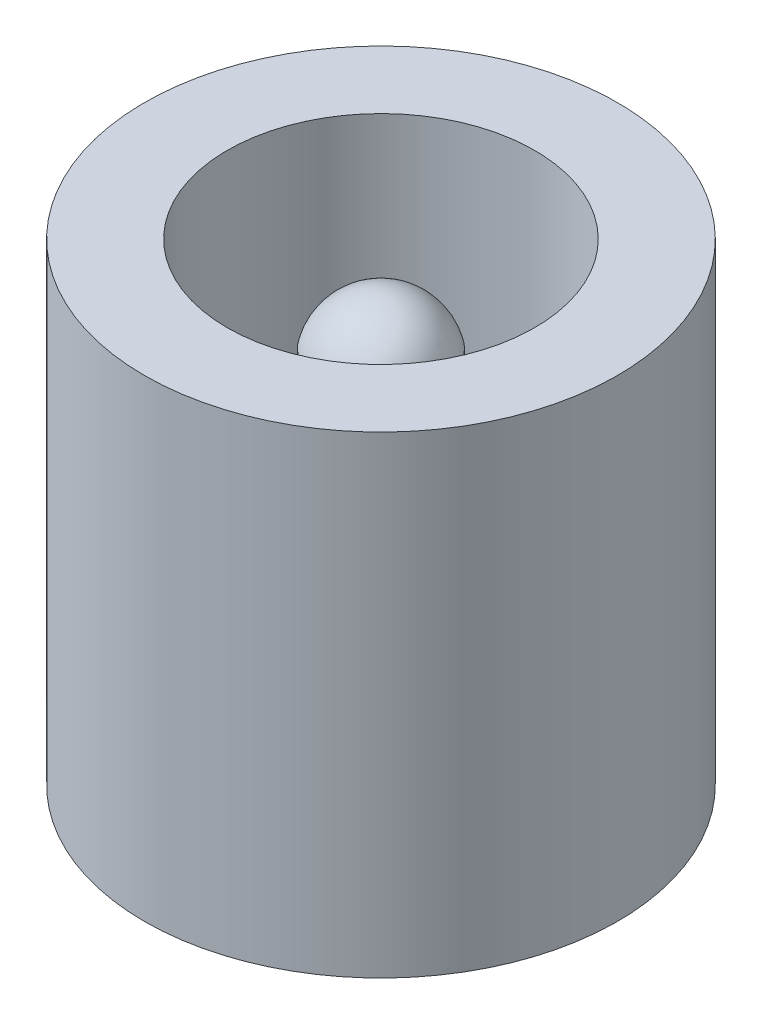
from build123d import *

# Parameters (mm, degrees)
SKETCH1_R           = 5
BOSS_EXTRUDE1_DEPTH = 10
SKETCH2_R           = 3.25
CUT_EXTRUDE1_DEPTH  = 8
SKETCH3_R           = 1.25
BOSS_EXTRUDE2_DEPTH = 6
DOME1_FACE_RADIUS   = 1.25
DOME1_HEIGHT        = 1


with BuildPart() as part:
    # Sketch1 → Boss-Extrude1 (new body)
    with BuildSketch(Plane(origin=(0, 0, 0), x_dir=(1, 0, 0), z_dir=(0, 1, 0))):
        with Locations(Location((0, 0, 0), (0, 0, 270))):
            Circle(SKETCH1_R)
    extrude(amount=BOSS_EXTRUDE1_DEPTH)

    # Sketch2 → Cut-Extrude1 (cut)
    with BuildSketch(Plane(origin=(0, 10, 0), x_dir=(1, 0, 0), z_dir=(0, 1, 0))):
        with Locations(Location((0, 0, 0), (0, 0, 270))):
            Circle(SKETCH2_R)
    extrude(amount=-CUT_EXTRUDE1_DEPTH, mode=Mode.SUBTRACT)

    # Sketch3 → Boss-Extrude2 (add)
    with BuildSketch(Plane(origin=(0, 2, 0), x_dir=(1, 0, 0), z_dir=(0, 1, 0))):
        with Locations(Location((0, 0, 0), (0, 0, 270))):
            Circle(SKETCH3_R)
    extrude(amount=BOSS_EXTRUDE2_DEPTH)

    # Dome1: a dome of height H over a round flat face of radius A is a cap of a sphere of radius (A * A + H * H) / (2 * H)
    dome1_r = (DOME1_FACE_RADIUS * DOME1_FACE_RADIUS + DOME1_HEIGHT * DOME1_HEIGHT) / (2 * DOME1_HEIGHT)
    dome1_base = Plane((0, 8, 0), z_dir=(0, 1, 0))
    with Locations(dome1_base.offset(DOME1_HEIGHT - dome1_r)):
        dome1_ball = Sphere(dome1_r, mode=Mode.PRIVATE)
    add(split(dome1_ball, bisect_by=dome1_base, keep=Keep.TOP, mode=Mode.PRIVATE))


solid = part.part
